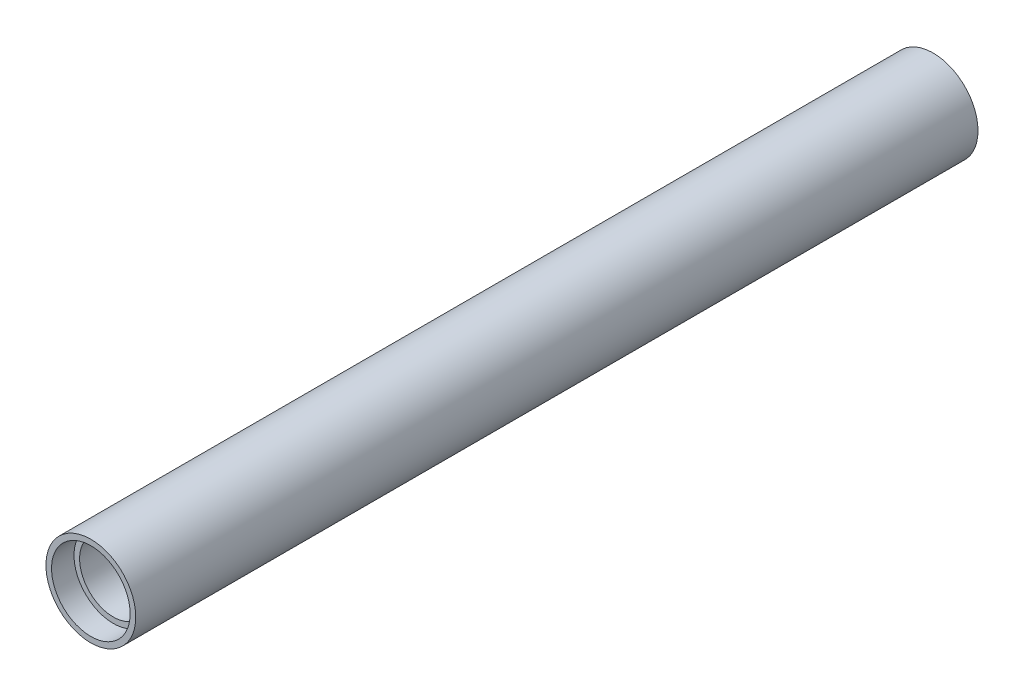
from build123d import *

# Parameters (mm, degrees)
SKETCH_1_R      = 24
SKETCH_1_R_2    = 21
EXTRUDE_1_DEPTH = 225
EXTRUDE_START   = -225
SKETCH_2_R      = 21
SKETCH_2_R_2    = 18
EXTRUDE_2_DEPTH = 213


with BuildPart() as part:
    # 草图1 → 拉伸-薄壁1 (new, symmetric)
    with BuildSketch(Plane.XY):
        Circle(SKETCH_1_R)
        Circle(SKETCH_1_R_2, mode=Mode.SUBTRACT)
    extrude(amount=EXTRUDE_1_DEPTH, both=True)

    # 草图2 → 拉伸-薄壁2 (add)
    with BuildSketch(Plane.XY.offset(225).offset(EXTRUDE_START)):
        Circle(SKETCH_2_R)
        Circle(SKETCH_2_R_2, mode=Mode.SUBTRACT)
    extrude_2 = extrude(amount=EXTRUDE_2_DEPTH)

    # 镜向1: 拉伸-薄壁2 across plane
    add(extrude_2.mirror(Plane.XY))


solid = part.part
